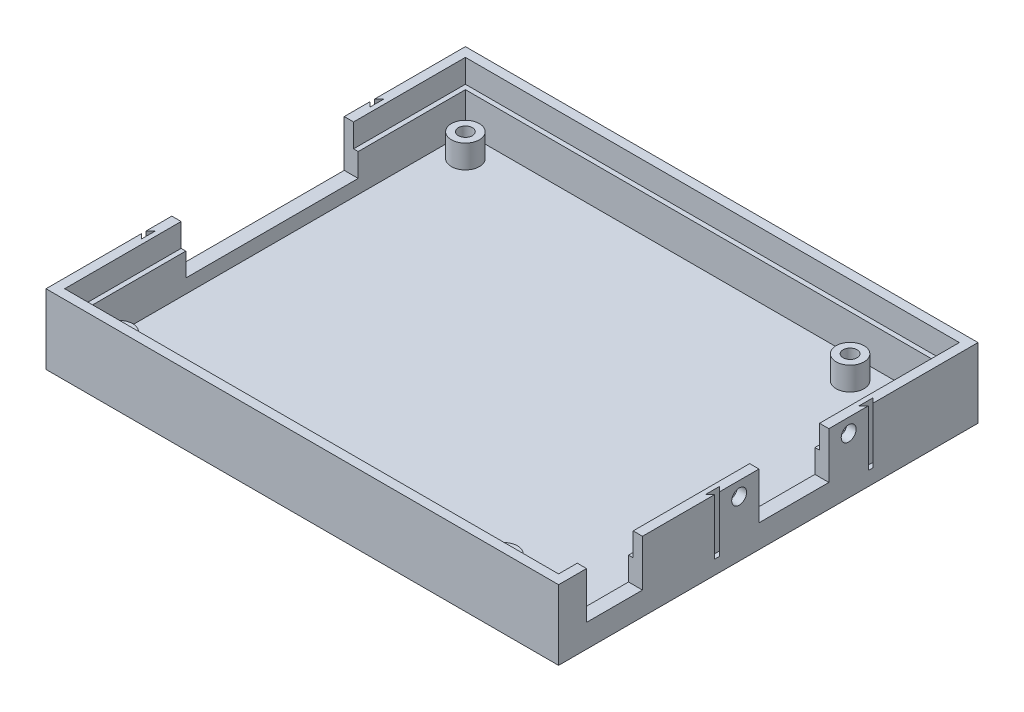
from build123d import *

# Parameters (mm, degrees)
CROQUIS1_W              = 110
CROQUIS1_H              = 90
SALIENTE_EXTRUIR1_DEPTH = 2
CROQUIS3_R              = 3
SALIENTE_EXTRUIR2_DEPTH = 5
CROQUIS4_R              = 1.5
CORTAR_EXTRUIR1_DEPTH   = 4
CROQUIS5_W              = 3
CROQUIS5_H              = 25
SALIENTE_EXTRUIR3_DEPTH = 13
CROQUIS6_W              = 3
CROQUIS6_H              = 37
CROQUIS6_H_2            = 15
CROQUIS6_H_3            = 12
SALIENTE_EXTRUIR4_DEPTH = 3
CROQUIS7_W              = 106
CROQUIS7_H              = 86
CROQUIS7_W_2            = 104
CROQUIS7_H_2            = 84
CORTAR_EXTRUIR2_DEPTH   = 5
CORTAR_EXTRUIR3_DEPTH   = 12
CROQUIS9_R              = 1.6
CORTAR_EXTRUIR4_DEPTH   = 12
CORTAR_EXTRUIR5_DEPTH   = 12


with BuildPart() as part:
    # Croquis1 → Saliente-Extruir1 (new body)
    with BuildSketch(Plane(origin=(0, 0, 0), x_dir=(1, 0, 0), z_dir=(0, 1, 0))):
        Rectangle(CROQUIS1_W, CROQUIS1_H)
    extrude(amount=SALIENTE_EXTRUIR1_DEPTH)

    # Croquis3 → Saliente-Extruir2 (add)
    with BuildSketch(Plane(origin=(0, 2, 0), x_dir=(1, 0, 0), z_dir=(0, 1, 0))):
        with Locations(Location((-47.19, -37.19, 0), (0, 0, 90))):
            Circle(CROQUIS3_R)
        with Locations(Location((-47.19, 37.19, 0), (0, 0, 90))):
            Circle(CROQUIS3_R)
        with Locations(Location((35.36, -37.19, 0), (0, 0, 90))):
            Circle(CROQUIS3_R)
        with Locations(Location((35.36, 37.19, 0), (0, 0, 90))):
            Circle(CROQUIS3_R)
    extrude(amount=SALIENTE_EXTRUIR2_DEPTH)

    # Croquis4 → Cortar-Extruir1 (cut)
    with BuildSketch(Plane(origin=(0, 7, 0), x_dir=(1, 0, 0), z_dir=(0, 1, 0))):
        with Locations(Location((-47.19, -37.19, 0), (0, 0, 270))):
            Circle(CROQUIS4_R)
        with Locations(Location((35.36, -37.19, 0), (0, 0, 270))):
            Circle(CROQUIS4_R)
        with Locations(Location((35.36, 37.19, 0), (0, 0, 270))):
            Circle(CROQUIS4_R)
        with Locations(Location((-47.19, 37.19, 0), (0, 0, 270))):
            Circle(CROQUIS4_R)
    extrude(amount=-CORTAR_EXTRUIR1_DEPTH, mode=Mode.SUBTRACT)

    # Croquis5 → Saliente-Extruir3 (add)
    with BuildSketch(Plane(origin=(0, 2, 0), x_dir=(1, 0, 0), z_dir=(0, 1, 0))):
        Polygon((52, -39), (55, -39), (55, -45), (-55, -45), (-55, -18), (-52, -18), (-52, -42), (52, -42), align=None)
        Polygon((-55, 45), (55, 45), (55, 13), (52, 13), (52, 42), (-52, 42), (-52, 19), (-55, 19), align=None)
        with Locations((53.5, -14.5)):
            Rectangle(CROQUIS5_W, CROQUIS5_H)
    extrude(amount=SALIENTE_EXTRUIR3_DEPTH)

    # Croquis6 → Saliente-Extruir4 (add)
    with BuildSketch(Plane(origin=(0, 2, 0), x_dir=(1, 0, 0), z_dir=(0, 1, 0))):
        with Locations((-53.5, 0.5)):
            Rectangle(CROQUIS6_W, CROQUIS6_H)
        with Locations((53.5, 5.5)):
            Rectangle(CROQUIS6_W, CROQUIS6_H_2)
        with Locations((53.5, -33)):
            Rectangle(CROQUIS6_W, CROQUIS6_H_3)
    extrude(amount=SALIENTE_EXTRUIR4_DEPTH)

    # Croquis7 → Cortar-Extruir2 (cut)
    with BuildSketch(Plane(origin=(0, 15, 0), x_dir=(1, 0, 0), z_dir=(0, 1, 0))):
        Rectangle(CROQUIS7_W, CROQUIS7_H)
        Rectangle(CROQUIS7_W_2, CROQUIS7_H_2, mode=Mode.SUBTRACT)
    extrude(amount=-CORTAR_EXTRUIR2_DEPTH, mode=Mode.SUBTRACT)

    # Croquis8 → Cortar-Extruir3 (cut)
    with BuildSketch(Plane(origin=(0, 15, 0), x_dir=(1, 0, 0), z_dir=(0, 1, 0))):
        Polygon((55, -10.5), (54, -9.5), (54, -12.5), (55, -11.5), align=None)
        Polygon((55, 22.5), (55, 21.5), (54, 20.5), (54, 23.5), align=None)
    extrude(amount=-CORTAR_EXTRUIR3_DEPTH, mode=Mode.SUBTRACT)

    # Croquis9 → Cortar-Extruir4 (cut)
    with BuildSketch(Plane(origin=(55, 0, 0), x_dir=(0, 0, -1), z_dir=(1, 0, 0))):
        with Locations((-6.25, 12)):
            Circle(CROQUIS9_R)
        with Locations((17.25, 12)):
            Circle(CROQUIS9_R)
    extrude(amount=-CORTAR_EXTRUIR4_DEPTH, mode=Mode.SUBTRACT)

    # Croquis11 → Cortar-Extruir5 (cut)
    with BuildSketch(Plane(origin=(0, 15, 0), x_dir=(1, 0, 0), z_dir=(0, 1, 0))):
        Polygon((-55, -23.5), (-54, -22.5), (-54, -25.5), (-55, -24.5), align=None)
        Polygon((-55, 25.5), (-55, 24.5), (-54, 23.5), (-54, 26.5), align=None)
    extrude(amount=-CORTAR_EXTRUIR5_DEPTH, mode=Mode.SUBTRACT)


solid = part.part
